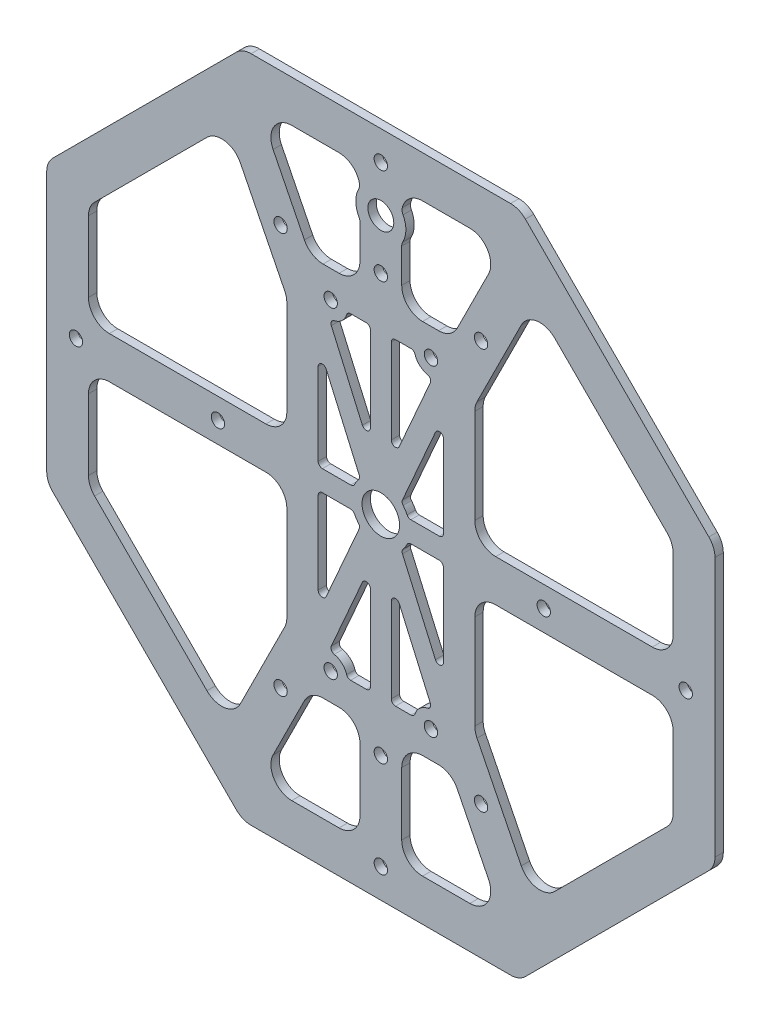
from build123d import *

# Parameters (mm, degrees)
SKETCH_1_W          = 160
SKETCH_1_H          = 160
EXTRUDE_1_DEPTH     = 2
SKETCH_2_R          = 4.5
SKETCH_2_R_2        = 1.6
CUT_EXTRUDE_1_DEPTH = 3
SKETCH_3_W          = 200
SKETCH_3_H          = 200
CUT_EXTRUDE_2_DEPTH = 10
CUT_EXTRUDE_3_DEPTH = 10
SKETCH_6_R          = 1.6
CUT_EXTRUDE_4_DEPTH = 10
FILLET_1_R          = 5
FILLET_2_R          = 5
CUT_EXTRUDE_5_DEPTH = 10
FILLET_3_R          = 1
SKETCH_8_R          = 1.6
CUT_EXTRUDE_6_DEPTH = 10
SKETCH_9_R          = 1.6
CUT_EXTRUDE_7_DEPTH = 10
SKETCH_10_R         = 3.1
CUT_EXTRUDE_8_DEPTH = 10
SKETCH_11_R         = 6
SKETCH_11_R_2       = 3.1
EXTRUDE_2_DEPTH     = 2
FILLET_4_R          = 2


with BuildPart() as part:
    # 草图1 → 凸台-拉伸1 (new body)
    with BuildSketch(Plane.XY):
        Rectangle(SKETCH_1_W, SKETCH_1_H)
    extrude(amount=EXTRUDE_1_DEPTH)

    # 草图2 → 切除-拉伸1 (cut)
    with BuildSketch(Plane.XY.offset(2)):
        Circle(SKETCH_2_R)
        with Locations((-73, 0)):
            Circle(SKETCH_2_R_2)
        with Locations((0, -73)):
            Circle(SKETCH_2_R_2)
        with Locations((73, 0)):
            Circle(SKETCH_2_R_2)
        with Locations((0, 73)):
            Circle(SKETCH_2_R_2)
    extrude(amount=-CUT_EXTRUDE_1_DEPTH, mode=Mode.SUBTRACT)

    # 草图3 → 切除-拉伸2 (cut)
    with BuildSketch(Plane.XY.offset(2)):
        Rectangle(SKETCH_3_W, SKETCH_3_H)
        Polygon((-33.13708499, 80), (-80, 33.13708499), (-80, -33.13708499), (-33.13708499, -80), (33.13708499, -80), (80, -33.13708499), (80, 33.13708499), (33.13708499, 80), align=None, mode=Mode.SUBTRACT)
    extrude(amount=-CUT_EXTRUDE_2_DEPTH, mode=Mode.SUBTRACT)

    # 草图5 → 切除-拉伸3 (cut)
    with BuildSketch(Plane.XY.offset(2)):
        Polygon((-70, -5), (-70, -28.994949366), (-36.725096418, -62.269852948), (-22.5, -33.819660113), (-22.5, -5), align=None)
        Polygon((-16.909830056, -45), (-29.409830056, -70), (-5, -70), (-5, -45), align=None)
        Polygon((16.909830056, -45), (5, -45), (5, -70), (29.409830056, -70), align=None)
        Polygon((22.5, -5), (22.5, -33.819660113), (36.725096418, -62.269852948), (70, -28.994949366), (70, -5), align=None)
        Polygon((22.5, 5), (70, 5), (70, 28.994949366), (36.725096418, 62.269852948), (22.5, 33.819660113), align=None)
        Polygon((16.909830056, 45), (29.409830056, 70), (5, 70), (5, 45), align=None)
        Polygon((-16.909830056, 45), (-5, 45), (-5, 70), (-29.409830056, 70), align=None)
        Polygon((-22.5, 5), (-22.5, 33.819660113), (-36.725096418, 62.269852948), (-70, 28.994949366), (-70, 5), align=None)
    extrude(amount=-CUT_EXTRUDE_3_DEPTH, mode=Mode.SUBTRACT)

    # 草图6 → 切除-拉伸4 (cut)
    with BuildSketch(Plane.XY.offset(2)):
        with Locations((-12, 38.5)):
            Circle(SKETCH_6_R)
        with Locations((-12, -38.5)):
            Circle(SKETCH_6_R)
        with Locations((12, -38.5)):
            Circle(SKETCH_6_R)
        with Locations((12, 38.5)):
            Circle(SKETCH_6_R)
    extrude(amount=-CUT_EXTRUDE_4_DEPTH, mode=Mode.SUBTRACT)

    # 圆角1
    fillet_1_edges = [part.edges().sort_by_distance(p)[0] for p in [
        (33.13708499, 80, 1),
        (80, 33.13708499, 1),
        (80, -33.13708499, 1),
        (33.13708499, -80, 1),
        (-33.13708499, -80, 1),
        (-80, -33.13708499, 1),
        (-80, 33.13708499, 1),
        (-33.13708499, 80, 1),
    ]]
    fillet(fillet_1_edges, radius=FILLET_1_R)

    # 圆角2
    fillet_2_edges = [part.edges().sort_by_distance(p)[0] for p in [
        (-22.5, -5, 1),
        (-22.5, -33.819660113, 1),
        (-36.725096418, -62.269852948, 1),
        (-70, -28.994949366, 1),
        (-70, -5, 1),
        (22.5, -5, 1),
        (70, -5, 1),
        (70, -28.994949366, 1),
        (36.725096418, -62.269852948, 1),
        (22.5, -33.819660113, 1),
        (16.909830056, 45, 1),
        (5, 45, 1),
        (5, 70, 1),
        (29.409830056, 70, 1),
        (22.5, 5, 1),
        (22.5, 33.819660113, 1),
        (36.725096418, 62.269852948, 1),
        (70, 28.994949366, 1),
        (70, 5, 1),
        (-22.5, 5, 1),
        (-70, 5, 1),
        (-70, 28.994949366, 1),
        (-36.725096418, 62.269852948, 1),
        (-22.5, 33.819660113, 1),
        (-16.909830056, 45, 1),
        (-29.409830056, 70, 1),
        (-5, 70, 1),
        (-5, 45, 1),
        (-16.909830056, -45, 1),
        (-5, -45, 1),
        (-5, -70, 1),
        (-29.409830056, -70, 1),
        (16.909830056, -45, 1),
        (29.409830056, -70, 1),
        (5, -70, 1),
        (5, -45, 1),
    ]]
    fillet(fillet_2_edges, radius=FILLET_2_R)

    # 草图7 → 切除-拉伸5 (cut)
    with BuildSketch(Plane.XY.offset(2)):
        with BuildLine():
            Line((-15, -2.5), (-15, -27.947607451))
            Line((-15, -27.947607451), (-4.917461161, -4.981824539))
            ThreePointArc((-4.917461161, -4.981824539), (-5.860781221, -3.827694277), (-6.538348415, -2.5))
            Line((-6.538348415, -2.5), (-15, -2.5))
        make_face()
        with BuildLine():
            Line((-2.5, -11.91350366), (-12.426010738, -34.522750341))
            ThreePointArc((-12.426010738, -34.522750341), (-9.517995017, -35.363178158), (-8.031373033, -38))
            Line((-8.031373033, -38), (-2.5, -38))
            Line((-2.5, -38), (-2.5, -11.91350366))
        make_face()
        with BuildLine():
            Line((2.5, -11.91350366), (12.426010738, -34.522750341))
            ThreePointArc((12.426010738, -34.522750341), (9.517995017, -35.363178158), (8.031373033, -38))
            Line((8.031373033, -38), (2.5, -38))
            Line((2.5, -38), (2.5, -11.91350366))
        make_face()
        with BuildLine():
            Line((15, -2.5), (6.538348415, -2.5))
            ThreePointArc((6.538348415, -2.5), (5.860781221, -3.827694277), (4.917461161, -4.981824539))
            Line((4.917461161, -4.981824539), (15, -27.947607451))
            Line((15, -27.947607451), (15, -2.5))
        make_face()
        with BuildLine():
            Line((15, 2.5), (15, 27.947607451))
            Line((15, 27.947607451), (4.917461161, 4.981824539))
            ThreePointArc((4.917461161, 4.981824539), (5.860781221, 3.827694277), (6.538348415, 2.5))
            Line((6.538348415, 2.5), (15, 2.5))
        make_face()
        with BuildLine():
            Line((8.031373033, 38), (2.5, 38))
            Line((2.5, 38), (2.5, 11.91350366))
            Line((2.5, 11.91350366), (12.426010738, 34.522750341))
            ThreePointArc((12.426010738, 34.522750341), (9.517995017, 35.363178158), (8.031373033, 38))
        make_face()
        with BuildLine():
            Line((-2.5, 11.91350366), (-12.426010738, 34.522750341))
            ThreePointArc((-12.426010738, 34.522750341), (-9.517995017, 35.363178158), (-8.031373033, 38))
            Line((-8.031373033, 38), (-2.5, 38))
            Line((-2.5, 38), (-2.5, 11.91350366))
        make_face()
        with BuildLine():
            Line((-15, 2.5), (-6.538348415, 2.5))
            ThreePointArc((-6.538348415, 2.5), (-5.860781221, 3.827694277), (-4.917461161, 4.981824539))
            Line((-4.917461161, 4.981824539), (-15, 27.947607451))
            Line((-15, 27.947607451), (-15, 2.5))
        make_face()
    extrude(amount=-CUT_EXTRUDE_5_DEPTH, mode=Mode.SUBTRACT)

    # 圆角3
    fillet_3_edges = [part.edges().sort_by_distance(p)[0] for p in [
        (15, 2.5, 1),
        (6.538348415, 2.5, 1),
        (4.917461161, 4.981824539, 1),
        (15, 27.947607451, 1),
        (15, -2.5, 1),
        (15, -27.947607451, 1),
        (4.917461161, -4.981824539, 1),
        (6.538348415, -2.5, 1),
        (-8.031373033, -38, 1),
        (-12.426010738, -34.522750341, 1),
        (-2.5, -11.91350366, 1),
        (-2.5, -38, 1),
        (12.426010738, -34.522750341, 1),
        (8.031373033, -38, 1),
        (2.5, -38, 1),
        (2.5, -11.91350366, 1),
        (-15, 2.5, 1),
        (-15, 27.947607451, 1),
        (-4.917461161, 4.981824539, 1),
        (-6.538348415, 2.5, 1),
        (-12.426010738, 34.522750341, 1),
        (-8.031373033, 38, 1),
        (-2.5, 38, 1),
        (-2.5, 11.91350366, 1),
        (8.031373033, 38, 1),
        (12.426010738, 34.522750341, 1),
        (2.5, 11.91350366, 1),
        (2.5, 38, 1),
        (-15, -2.5, 1),
        (-6.538348415, -2.5, 1),
        (-4.917461161, -4.981824539, 1),
        (-15, -27.947607451, 1),
    ]]
    fillet(fillet_3_edges, radius=FILLET_3_R)

    # 草图8 → 切除-拉伸6 (cut)
    with BuildSketch(Plane.XY.offset(2)):
        with Locations((-39, 0)):
            Circle(SKETCH_8_R)
        with Locations((0, -50)):
            Circle(SKETCH_8_R)
        with Locations((39, 0)):
            Circle(SKETCH_8_R)
        with Locations((0, 50)):
            Circle(SKETCH_8_R)
    extrude(amount=-CUT_EXTRUDE_6_DEPTH, mode=Mode.SUBTRACT)

    # 草图9 → 切除-拉伸7 (cut)
    with BuildSketch(Plane.XY.offset(2)):
        with Locations((-24, -48)):
            Circle(SKETCH_9_R)
        with Locations((24, -48)):
            Circle(SKETCH_9_R)
        with Locations((24, 48)):
            Circle(SKETCH_9_R)
        with Locations((-24, 48)):
            Circle(SKETCH_9_R)
    extrude(amount=-CUT_EXTRUDE_7_DEPTH, mode=Mode.SUBTRACT)

    # 草图10 → 切除-拉伸8 (cut)
    with BuildSketch(Plane.XY.offset(2)):
        with Locations((0, 62)):
            Circle(SKETCH_10_R)
    extrude(amount=-CUT_EXTRUDE_8_DEPTH, mode=Mode.SUBTRACT)

    # 草图11 → 凸台-拉伸2 (add)
    with BuildSketch(Plane.XY.offset(2)):
        with Locations((0, 62)):
            Circle(SKETCH_11_R)
        with Locations((0, 62)):
            Circle(SKETCH_11_R_2, mode=Mode.SUBTRACT)
    extrude(amount=-EXTRUDE_2_DEPTH)

    # 圆角4
    fillet_4_edges = [part.edges().sort_by_distance(p)[0] for p in [
        (5.009174312, 65.302752294, 1),
        (-5, 58.68337521, 1),
        (5, 58.68337521, 1),
        (-5.009174312, 65.302752294, 1),
    ]]
    fillet(fillet_4_edges, radius=FILLET_4_R)


solid = part.part
